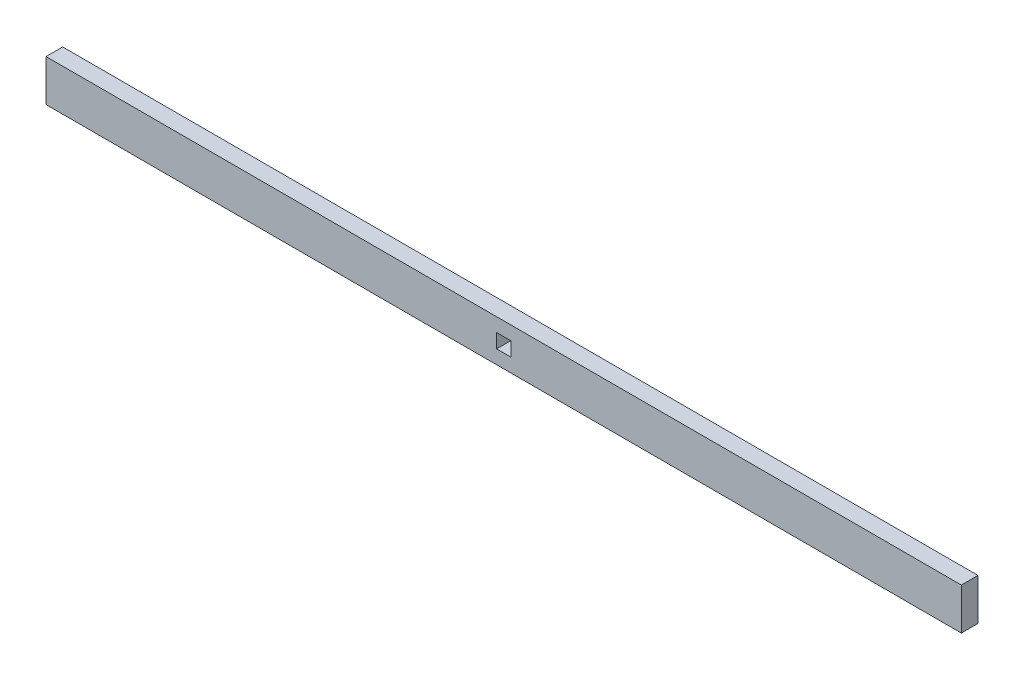
from build123d import *

# Parameters (mm, degrees)
SKETCH_1_W          = 1100
SKETCH_1_H          = 50
EXTRUDE_1_DEPTH     = 20
SKETCH_2_W          = 17
SKETCH_2_H          = 17
CUT_EXTRUDE_1_DEPTH = 18


with BuildPart() as part:
    # 草图1 → 凸台-拉伸1 (new body)
    with BuildSketch(Plane.XY):
        Rectangle(SKETCH_1_W, SKETCH_1_H)
    extrude(amount=EXTRUDE_1_DEPTH)

    # 草图2 → 切除-拉伸1 (cut)
    with BuildSketch(Plane.XY.offset(20)):
        Rectangle(SKETCH_2_W, SKETCH_2_H)
    extrude(amount=-CUT_EXTRUDE_1_DEPTH, mode=Mode.SUBTRACT)


solid = part.part
